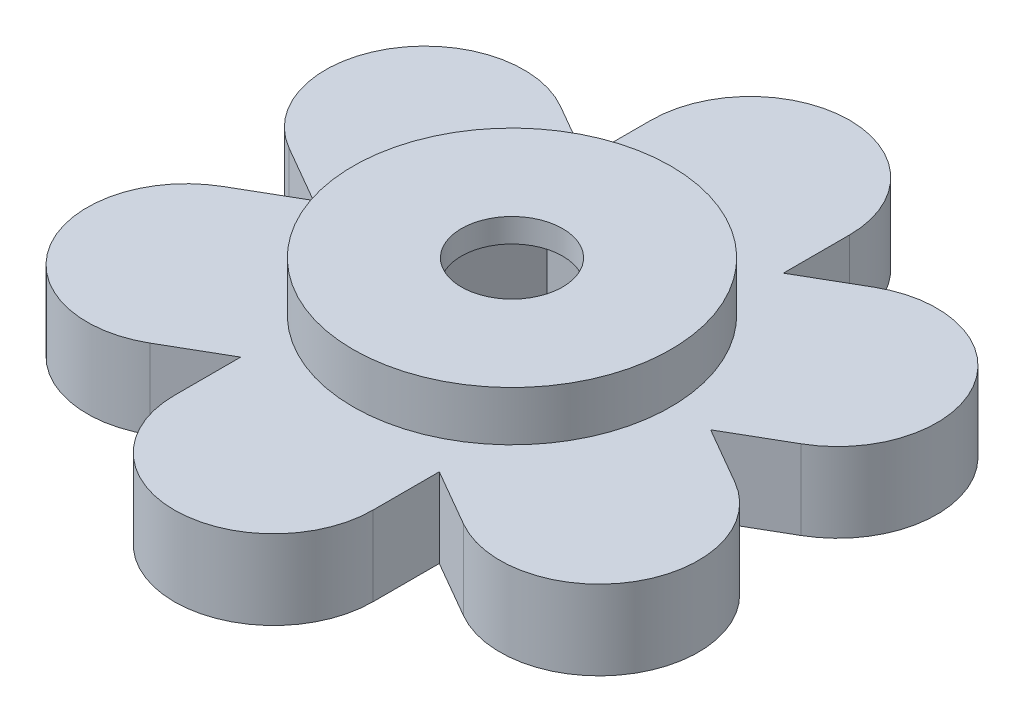
from build123d import *

# Parameters (mm, degrees)
SKETCH1_R           = 8
BOSS_EXTRUDE1_DEPTH = 6.5
CUT_EXTRUDE1_START  = 1.2
CUT_EXTRUDE1_DEPTH  = 4.1
CUT_EXTRUDE2_REACH  = 15.048
SKETCH5_R           = 2.55
BOSS_EXTRUDE4_DEPTH = 4
CIRPATTERN1_COUNT   = 6


with BuildPart() as part:
    # Sketch1 → Boss-Extrude1 (new body)
    with BuildSketch(Plane(origin=(0, 0, 0), x_dir=(1, 0, 0), z_dir=(0, 1, 0))):
        with Locations(Location((0, 0, 0), (0, 0, 90))):
            Circle(SKETCH1_R)
    extrude(amount=BOSS_EXTRUDE1_DEPTH)

    # Sketch4 → Cut-Extrude1 (cut)
    with BuildSketch(Plane(origin=(0, 0, 0), x_dir=(1, 0, 0), z_dir=(0, 1, 0)).offset(CUT_EXTRUDE1_START)):
        Polygon((4.792007234, 0), (2.396003617, 4.15), (-2.396003617, 4.15), (-4.792007234, 0), (-2.396003617, -4.15), (2.396003617, -4.15), align=None)
    extrude(amount=CUT_EXTRUDE1_DEPTH, mode=Mode.SUBTRACT)

    # Cut-Extrude2: up to this face of the body (flat: up to its plane)
    cut_extrude2_end = Plane(part.part.faces().sort_by_distance((0, 6.5, 0))[0])
    # Sketch5 → Cut-Extrude2 (cut, up to the picked face)
    with BuildSketch(Plane(origin=(0, 0, 0), x_dir=(1, 0, 0), z_dir=(0, 1, 0)), mode=Mode.PRIVATE) as cut_extrude2_sk1:
        with Locations(Location((0, 0, 0), (0, 0, 90))):
            Circle(SKETCH5_R)
    cut_extrude2_tool1 = split(extrude(cut_extrude2_sk1.sketch, amount=CUT_EXTRUDE2_REACH, mode=Mode.PRIVATE), bisect_by=cut_extrude2_end, keep=Keep.BOTH, mode=Mode.PRIVATE)
    add(cut_extrude2_tool1.solids().sort_by(Axis((0, 0, 0), (0, 1, 0)))[0], mode=Mode.SUBTRACT)

    # Sketch6 → Boss-Extrude4 (add)
    with BuildSketch(Plane(origin=(0, 0, 0), x_dir=(1, 0, 0), z_dir=(0, 1, 0))):
        with BuildLine():
            Line((-5, 12), (-5, 6.244997998))
            ThreePointArc((-5, 6.244997998), (0, 8), (5, 6.244997998))
            Line((5, 6.244997998), (5, 12))
            ThreePointArc((5, 12), (0, 17), (-5, 12))
        make_face()
    boss_extrude4 = extrude(amount=BOSS_EXTRUDE4_DEPTH)

    # CirPattern1: Boss-Extrude4 ×6 about axis
    cirpattern1_axis = Axis((0, 0, 0), (0, 1, 0))
    for i in range(1, CIRPATTERN1_COUNT):
        add(boss_extrude4.rotate(cirpattern1_axis, i * 360 / CIRPATTERN1_COUNT))


solid = part.part
